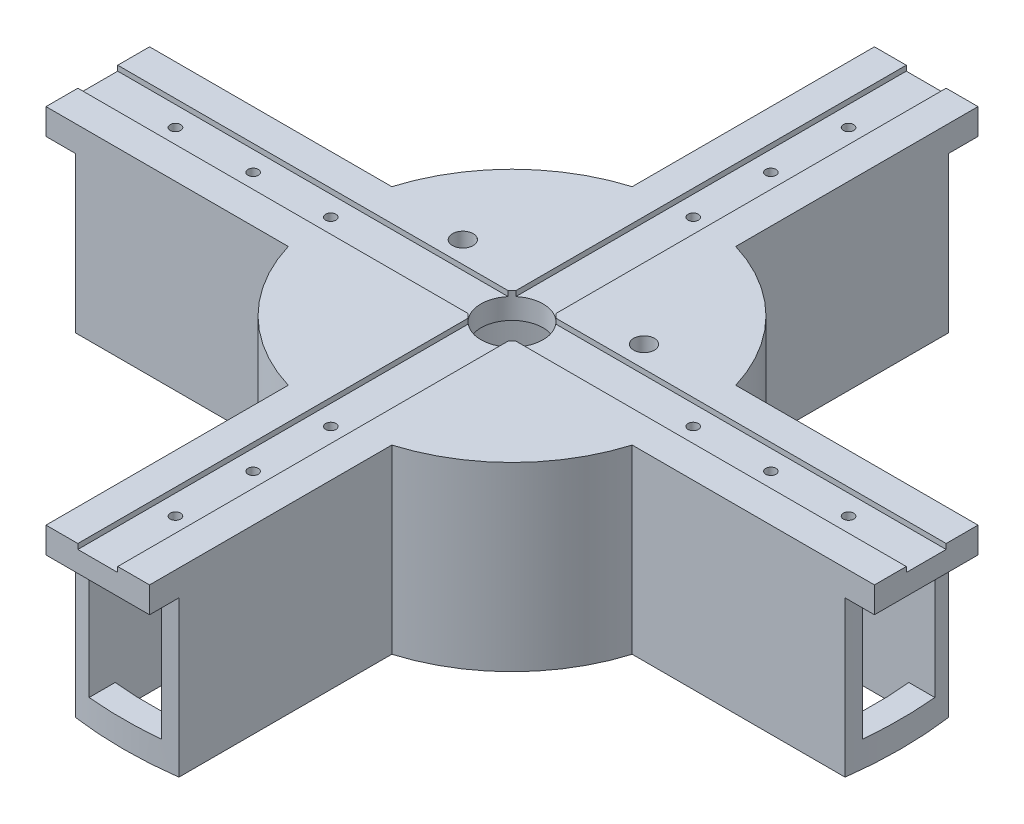
from build123d import *

# Parameters (mm, degrees)
EXTRUDE_1_DEPTH             = 5
EXTRUDE_2_DEPTH             = 25
EXTRUDE_3_DEPTH             = 25
EXTRUDE_4_DEPTH             = 25
EXTRUDE_5_DEPTH             = 25
EXTRUDE_6_DEPTH             = 5
CUT_EXTRUDE_1_DEPTH         = 1
CUT_EXTRUDE_2_DEPTH         = 5
CUT_EXTRUDE_3_DEPTH         = 5
CUT_EXTRUDE_4_DEPTH         = 5
CUT_EXTRUDE_5_DEPTH         = 25
CUT_EXTRUDE_6_DEPTH         = 0.342275074
CUT_EXTRUDE_START           = -5
CUT_EXTRUDE_7_DEPTH         = 5
EXTRUDE_7_DEPTH             = 0.342275074
CUT_EXTRUDE_8_DEPTH         = 25
CUT_EXTRUDE_9_DEPTH         = 0.342275074
CUT_EXTRUDE_10_DEPTH        = 5
EXTRUDE_8_DEPTH             = 0.342275074
EXTRUDE_9_DEPTH             = 5.32738119
EXTRUDE_10_DEPTH            = 5.32738119
EXTRUDE_11_DEPTH            = 5.32738119
CUT_EXTRUDE_11_DEPTH        = 25
EXTRUDE_12_DEPTH            = 5.32738119
HOLE_WIZARD_2_0_2_1_D       = 2
HOLE_WIZARD_2_0_2_1_DEPTH   = 5
HOLE_WIZARD_12_0_12_1_D     = 12
HOLE_WIZARD_12_0_12_1_DEPTH = 5
HOLE_WIZARD_2_0_2_2_D       = 2
HOLE_WIZARD_2_0_2_2_DEPTH   = 34
HOLE_WIZARD_4_0_4_1_D       = 4


with BuildPart() as part:
    # 草图1 → 凸台-拉伸1 (new body)
    with BuildSketch(Plane.XZ.offset(30)):
        with BuildLine():
            Line((-7, 74.67261881), (-10, 74.67261881))
            Line((-10, 74.67261881), (-10, 33.215052396))
            ThreePointArc((-10, 33.215052396), (-24.527940249, 24.527940249), (-33.215052396, 10))
            Line((-33.215052396, 10), (-74.330343737, 10))
            add(Edge.make_bspline(
                [(-74.67261881, 10), (-74.558527119, 10), (-74.444435428, 10), (-74.330343737, 10)],
                knots=[0, 0, 0, 0, 1, 1, 1, 1], degree=3))
            Line((-74.67261881, 10), (-74.67261881, 7))
            ThreePointArc((-74.67261881, 7), (-74.984803207, -1.509731121), (-74.330343737, -10))
            Line((-74.330343737, -10), (-33.215052396, -10))
            ThreePointArc((-33.215052396, -10), (-24.527940249, -24.527940249), (-10, -33.215052396))
            Line((-10, -33.215052396), (-10, -74.330343737))
            ThreePointArc((-10, -74.330343737), (0, -75), (10, -74.330343737))
            Line((10, -74.330343737), (10, -33.215052396))
            ThreePointArc((10, -33.215052396), (24.527940249, -24.527940249), (33.215052396, -10))
            Line((33.215052396, -10), (74.330343737, -10))
            add(Edge.make_bspline(
                [(74.67261881, -10), (74.558527119, -10), (74.444435428, -10), (74.330343737, -10)],
                knots=[0, 0, 0, 0, 1, 1, 1, 1], degree=3))
            Line((74.67261881, -10), (74.67261881, -7))
            ThreePointArc((74.67261881, -7), (74.984803207, 1.509731121), (74.330343737, 10))
            Line((74.330343737, 10), (33.215052396, 10))
            ThreePointArc((33.215052396, 10), (24.527940249, 24.527940249), (10, 33.215052396))
            Line((10, 33.215052396), (10, 74.330343737))
            ThreePointArc((10, 74.330343737), (1.509731121, 74.984803207), (-7, 74.67261881))
        make_face()
        with BuildLine():
            Line((-69.649120597, 7), (-30.904906263, 7))
            ThreePointArc((-30.904906263, 7), (-22.406619905, 22.406619905), (-7, 30.904906263))
            Line((-7, 30.904906263), (-7, 69.649120597))
            ThreePointArc((-7, 69.649120597), (0, 70), (7, 69.649120597))
            Line((7, 69.649120597), (7, 30.904906263))
            ThreePointArc((7, 30.904906263), (22.406619905, 22.406619905), (30.904906263, 7))
            Line((30.904906263, 7), (69.649120597, 7))
            ThreePointArc((69.649120597, 7), (70, 0), (69.649120597, -7))
            Line((69.649120597, -7), (30.904906263, -7))
            ThreePointArc((30.904906263, -7), (22.406619905, -22.406619905), (7, -30.904906263))
            Line((7, -30.904906263), (7, -69.649120597))
            ThreePointArc((7, -69.649120597), (0, -70), (-7, -69.649120597))
            Line((-7, -69.649120597), (-7, -30.904906263))
            ThreePointArc((-7, -30.904906263), (-22.406619905, -22.406619905), (-30.904906263, -7))
            Line((-30.904906263, -7), (-69.649120597, -7))
            ThreePointArc((-69.649120597, -7), (-70, 0), (-69.649120597, 7))
        make_face(mode=Mode.SUBTRACT)
    extrude(amount=-EXTRUDE_1_DEPTH)

    # 草图2 → 凸台-拉伸2 (add)
    with BuildSketch(Plane(origin=(0, -25, 0), x_dir=(-1, 0, 0), z_dir=(0, 1, 0))):
        with BuildLine():
            Line((74.67261881, 7), (30.904906263, 7))
            ThreePointArc((30.904906263, 7), (22.406619905, 22.406619905), (7, 30.904906263))
            Line((7, 30.904906263), (7, 74.67261881))
            Line((7, 74.67261881), (10, 74.67261881))
            Line((10, 74.67261881), (10, 33.215052396))
            ThreePointArc((10, 33.215052396), (24.527940249, 24.527940249), (33.215052396, 10))
            Line((33.215052396, 10), (74.67261881, 10))
            Line((74.67261881, 10), (74.67261881, 7))
        make_face()
    extrude(amount=EXTRUDE_2_DEPTH)

    # 草图3 → 凸台-拉伸3 (add)
    with BuildSketch(Plane(origin=(0, -25, 0), x_dir=(-1, 0, 0), z_dir=(0, 1, 0))):
        with BuildLine():
            Line((-74.67261881, -7), (-30.904906263, -7))
            ThreePointArc((-30.904906263, -7), (-22.406619905, -22.406619905), (-7, -30.904906263))
            Line((-7, -30.904906263), (-7, -74.67261881))
            ThreePointArc((-7, -74.67261881), (-8.501722652, -74.516580114), (-10, -74.330343737))
            Line((-10, -74.330343737), (-10, -33.215052396))
            ThreePointArc((-10, -33.215052396), (-24.527940249, -24.527940249), (-33.215052396, -10))
            Line((-33.215052396, -10), (-74.67261881, -10))
            Line((-74.67261881, -10), (-74.67261881, -7))
        make_face()
    extrude(amount=EXTRUDE_3_DEPTH)

    # 草图4 → 凸台-拉伸4 (add)
    with BuildSketch(Plane(origin=(0, -25, 0), x_dir=(-1, 0, 0), z_dir=(0, 1, 0))):
        with BuildLine():
            Line((-30.904906263, 7), (-74.67261881, 7))
            ThreePointArc((-74.67261881, 7), (-74.516580114, 8.501722652), (-74.330343737, 10))
            Line((-74.330343737, 10), (-33.215052396, 10))
            ThreePointArc((-33.215052396, 10), (-24.527940249, 24.527940249), (-10, 33.215052396))
            Line((-10, 33.215052396), (-10, 74.330343737))
            ThreePointArc((-10, 74.330343737), (-8.501722652, 74.516580114), (-7, 74.67261881))
            Line((-7, 74.67261881), (-7, 30.904906263))
            ThreePointArc((-7, 30.904906263), (-22.406619905, 22.406619905), (-30.904906263, 7))
        make_face()
    extrude(amount=EXTRUDE_4_DEPTH)

    # 草图5 → 凸台-拉伸5 (add)
    with BuildSketch(Plane(origin=(0, -25, 0), x_dir=(-1, 0, 0), z_dir=(0, 1, 0))):
        with BuildLine():
            Line((30.904906263, -7), (74.67261881, -7))
            ThreePointArc((74.67261881, -7), (74.516580114, -8.501722652), (74.330343737, -10))
            Line((74.330343737, -10), (33.215052396, -10))
            ThreePointArc((33.215052396, -10), (24.527940249, -24.527940249), (10, -33.215052396))
            Line((10, -33.215052396), (10, -74.330343737))
            ThreePointArc((10, -74.330343737), (8.501722652, -74.516580114), (7, -74.67261881))
            Line((7, -74.67261881), (7, -30.904906263))
            ThreePointArc((7, -30.904906263), (22.406619905, -22.406619905), (30.904906263, -7))
        make_face()
    extrude(amount=EXTRUDE_5_DEPTH)

    # 草图6 → 凸台-拉伸6 (add)
    with BuildSketch(Plane(origin=(0, 0, 0), x_dir=(-1, 0, 0), z_dir=(0, 1, 0))):
        with BuildLine():
            Line((-74.67261881, -10), (-74.67261881, 7))
            ThreePointArc((-74.67261881, 7), (-74.516580114, 8.501722652), (-74.330343737, 10))
            Line((-74.330343737, 10), (-33.215052396, 10))
            ThreePointArc((-33.215052396, 10), (-24.527940249, 24.527940249), (-10, 33.215052396))
            Line((-10, 33.215052396), (-10, 74.67261881))
            Line((-10, 74.67261881), (10, 74.67261881))
            Line((10, 74.67261881), (10, 33.215052396))
            ThreePointArc((10, 33.215052396), (24.527940249, 24.527940249), (33.215052396, 10))
            Line((33.215052396, 10), (74.330343737, 10))
            add(Edge.make_bspline(
                [(74.67261881, 10), (74.558527119, 10), (74.444435428, 10), (74.330343737, 10)],
                knots=[0, 0, 0, 0, 1, 1, 1, 1], degree=3))
            Line((74.67261881, 10), (74.67261881, -7))
            ThreePointArc((74.67261881, -7), (74.516580114, -8.501722652), (74.330343737, -10))
            Line((74.330343737, -10), (33.215052396, -10))
            ThreePointArc((33.215052396, -10), (24.527940249, -24.527940249), (10, -33.215052396))
            Line((10, -33.215052396), (10, -74.67261881))
            Line((10, -74.67261881), (-10, -74.67261881))
            Line((-10, -74.67261881), (-10, -33.215052396))
            ThreePointArc((-10, -33.215052396), (-24.527940249, -24.527940249), (-33.215052396, -10))
            Line((-33.215052396, -10), (-74.330343737, -10))
            add(Edge.make_bspline(
                [(-74.67261881, -10), (-74.558527119, -10), (-74.444435428, -10), (-74.330343737, -10)],
                knots=[0, 0, 0, 0, 1, 1, 1, 1], degree=3))
        make_face()
    extrude(amount=EXTRUDE_6_DEPTH)

    # 草图7 → 切除-拉伸1 (cut)
    with BuildSketch(Plane(origin=(0, 5, 0), x_dir=(-1, 0, 0), z_dir=(0, 1, 0))):
        with BuildLine():
            Line((3.85, -3.85), (74.330343737, -3.85))
            add(Edge.make_bspline(
                [(74.67261881, -3.85), (74.558527119, -3.85), (74.444435428, -3.85), (74.330343737, -3.85)],
                knots=[0, 0, 0, 0, 1, 1, 1, 1], degree=3))
            Line((74.67261881, -3.85), (74.67261881, 3.85))
            add(Edge.make_bspline(
                [(74.67261881, 3.85), (74.558527119, 3.85), (74.444435428, 3.85), (74.330343737, 3.85)],
                knots=[0, 0, 0, 0, 1, 1, 1, 1], degree=3))
            Line((74.330343737, 3.85), (3.85, 3.85))
            Line((3.85, 3.85), (3.85, 74.67261881))
            Line((3.85, 74.67261881), (-3.85, 74.67261881))
            Line((-3.85, 74.67261881), (-3.85, 3.85))
            Line((-3.85, 3.85), (-74.330343737, 3.85))
            add(Edge.make_bspline(
                [(-74.67261881, 3.85), (-74.558527119, 3.85), (-74.444435428, 3.85), (-74.330343737, 3.85)],
                knots=[0, 0, 0, 0, 1, 1, 1, 1], degree=3))
            Line((-74.67261881, 3.85), (-74.67261881, -3.85))
            add(Edge.make_bspline(
                [(-74.67261881, -3.85), (-74.558527119, -3.85), (-74.444435428, -3.85), (-74.330343737, -3.85)],
                knots=[0, 0, 0, 0, 1, 1, 1, 1], degree=3))
            Line((-74.330343737, -3.85), (-3.85, -3.85))
            Line((-3.85, -3.85), (-3.85, -74.67261881))
            Line((-3.85, -74.67261881), (3.85, -74.67261881))
            Line((3.85, -74.67261881), (3.85, -3.85))
        make_face()
    extrude(amount=-CUT_EXTRUDE_1_DEPTH, mode=Mode.SUBTRACT)

    # 草图8 → 切除-拉伸2 (cut)
    with BuildSketch(Plane.XZ.offset(30)):
        with BuildLine():
            Line((-7, 74.67261881), (-10, 74.67261881))
            Line((-10, 74.67261881), (-10, 74.330343737))
            ThreePointArc((-10, 74.330343737), (-8.501722652, 74.516580114), (-7, 74.67261881))
        make_face()
    extrude(amount=-CUT_EXTRUDE_2_DEPTH, mode=Mode.SUBTRACT)

    # 草图9 → 切除-拉伸3 (cut)
    with BuildSketch(Plane.XZ.offset(30)):
        with BuildLine():
            Line((-74.67261881, 10), (-74.67261881, 7))
            ThreePointArc((-74.67261881, 7), (-74.516580114, 8.501722652), (-74.330343737, 10))
            add(Edge.make_bspline(
                [(-74.67261881, 10), (-74.558527119, 10), (-74.444435428, 10), (-74.330343737, 10)],
                knots=[0, 0, 0, 0, 1, 1, 1, 1], degree=3))
        make_face()
    extrude(amount=-CUT_EXTRUDE_3_DEPTH, mode=Mode.SUBTRACT)

    # 草图10 → 切除-拉伸4 (cut)
    with BuildSketch(Plane.XZ.offset(30)):
        with BuildLine():
            Line((74.67261881, -10), (74.67261881, -7))
            ThreePointArc((74.67261881, -7), (74.516580114, -8.501722652), (74.330343737, -10))
            add(Edge.make_bspline(
                [(74.67261881, -10), (74.558527119, -10), (74.444435428, -10), (74.330343737, -10)],
                knots=[0, 0, 0, 0, 1, 1, 1, 1], degree=3))
        make_face()
    extrude(amount=-CUT_EXTRUDE_4_DEPTH, mode=Mode.SUBTRACT)

    # 草图11 → 切除-拉伸5 (cut)
    with BuildSketch(Plane.XZ.offset(25)):
        with BuildLine():
            Line((-74.67261881, 10), (-74.67261881, 7))
            ThreePointArc((-74.67261881, 7), (-74.516580114, 8.501722652), (-74.330343737, 10))
            add(Edge.make_bspline(
                [(-74.67261881, 10), (-74.558527119, 10), (-74.444435428, 10), (-74.330343737, 10)],
                knots=[0, 0, 0, 0, 1, 1, 1, 1], degree=3))
        make_face()
    extrude(amount=-CUT_EXTRUDE_5_DEPTH, mode=Mode.SUBTRACT)

    # 草图12 → 切除-拉伸6 (cut)
    with BuildSketch(Plane.ZY.offset(74.67261881)):
        Polygon((-3.85, 5), (-7, 5), (-7, 0), (7, 0), (10, 0), (10, 5), (3.85, 5), (3.85, 4), (-3.85, 4), align=None)
    extrude(amount=-CUT_EXTRUDE_6_DEPTH, mode=Mode.SUBTRACT)

    # 草图13 → 切除-拉伸7 (cut)
    with BuildSketch(Plane(origin=(0, 5, 0), x_dir=(-1, 0, 0), z_dir=(0, 1, 0)).offset(CUT_EXTRUDE_START)):
        with BuildLine():
            Line((74.67261881, -7), (74.330343737, -7))
            Line((74.330343737, -7), (74.330343737, -10))
            ThreePointArc((74.330343737, -10), (74.516580114, -8.501722652), (74.67261881, -7))
        make_face()
    extrude(amount=CUT_EXTRUDE_7_DEPTH, mode=Mode.SUBTRACT)

    # 草图14 → 凸台-拉伸7 (add)
    with BuildSketch(Plane.ZY.offset(74.330343737)):
        Polygon((3.85, 4), (3.85, 5), (10, 5), (10, 0), (7, 0), (-7, 0), (-10, 0), (-10, 5), (-3.85, 5), (-3.85, 4), align=None)
    extrude(amount=EXTRUDE_7_DEPTH)

    # 草图15 → 切除-拉伸8 (cut)
    with BuildSketch(Plane.XZ.offset(25)):
        with BuildLine():
            Line((74.67261881, -10), (74.67261881, -7))
            ThreePointArc((74.67261881, -7), (74.516580114, -8.501722652), (74.330343737, -10))
            add(Edge.make_bspline(
                [(74.67261881, -10), (74.558527119, -10), (74.444435428, -10), (74.330343737, -10)],
                knots=[0, 0, 0, 0, 1, 1, 1, 1], degree=3))
        make_face()
    extrude(amount=-CUT_EXTRUDE_8_DEPTH, mode=Mode.SUBTRACT)

    # 草图16 → 切除-拉伸9 (cut)
    with BuildSketch(Plane(origin=(74.67261881, 0, 0), x_dir=(0, 0, -1), z_dir=(1, 0, 0))):
        Polygon((-3.85, 5), (-7, 5), (-7, 0), (7, 0), (10, 0), (10, 5), (3.85, 5), (3.85, 4), (-3.85, 4), align=None)
    extrude(amount=-CUT_EXTRUDE_9_DEPTH, mode=Mode.SUBTRACT)

    # 草图17 → 切除-拉伸10 (cut)
    with BuildSketch(Plane(origin=(0, 5, 0), x_dir=(-1, 0, 0), z_dir=(0, 1, 0)).offset(CUT_EXTRUDE_START)):
        with BuildLine():
            Line((-74.67261881, 7), (-74.330343737, 7))
            Line((-74.330343737, 7), (-74.330343737, 10))
            ThreePointArc((-74.330343737, 10), (-74.516580114, 8.501722652), (-74.67261881, 7))
        make_face()
    extrude(amount=CUT_EXTRUDE_10_DEPTH, mode=Mode.SUBTRACT)

    # 草图18 → 凸台-拉伸8 (add)
    with BuildSketch(Plane(origin=(74.330343737, 0, 0), x_dir=(0, 0, -1), z_dir=(1, 0, 0))):
        Polygon((-3.85, 5), (-3.85, 4), (3.85, 4), (3.85, 5), (10, 5), (10, 0), (7, 0), (-7, 0), (-10, 0), (-10, 5), align=None)
    extrude(amount=EXTRUDE_8_DEPTH)

    # 草图19 → 凸台-拉伸9 (add)
    with BuildSketch(Plane(origin=(0, 0, -74.67261881), x_dir=(-1, 0, 0), z_dir=(0, 0, -1))):
        Polygon((3.85, 4), (3.85, 5), (10, 5), (10, 0), (-10, 0), (-10, 5), (-3.85, 5), (-3.85, 4), align=None)
    extrude(amount=EXTRUDE_9_DEPTH)

    # 草图20 → 凸台-拉伸10 (add)
    with BuildSketch(Plane(origin=(74.67261881, 0, 0), x_dir=(0, 0, -1), z_dir=(1, 0, 0))):
        Polygon((-3.85, 5), (-3.85, 4), (3.85, 4), (3.85, 5), (10, 5), (10, 0), (-10, 0), (-10, 5), align=None)
    extrude(amount=EXTRUDE_10_DEPTH)

    # 草图21 → 凸台-拉伸11 (add)
    with BuildSketch(Plane.ZY.offset(74.67261881)):
        Polygon((3.85, 4), (3.85, 5), (10, 5), (10, 0), (-10, 0), (-10, 5), (-3.85, 5), (-3.85, 4), align=None)
    extrude(amount=EXTRUDE_11_DEPTH)

    # 草图22 → 切除-拉伸11 (cut)
    with BuildSketch(Plane.XZ.offset(25)):
        with BuildLine():
            Line((-7, 74.67261881), (-10, 74.67261881))
            Line((-10, 74.67261881), (-10, 74.330343737))
            ThreePointArc((-10, 74.330343737), (-8.501722652, 74.516580114), (-7, 74.67261881))
        make_face()
    extrude(amount=-CUT_EXTRUDE_11_DEPTH, mode=Mode.SUBTRACT)

    # 草图23 → 凸台-拉伸12 (add)
    with BuildSketch(Plane.XY.offset(74.67261881)):
        Polygon((3.85, 4), (3.85, 5), (10, 5), (10, 0), (-10, 0), (-10, 5), (-3.85, 5), (-3.85, 4), align=None)
    extrude(amount=EXTRUDE_12_DEPTH)

    # Ø2.0 (2) 直径孔1
    with Locations(Plane(origin=(0, 0, 0), x_dir=(-1, 0, 0), z_dir=(0, -1, 0))):
        with Locations((-50, 0), (-35, 0), (-65, 0), (50, 0), (35, 0), (65, 0)):
            Hole(HOLE_WIZARD_2_0_2_1_D / 2, depth=HOLE_WIZARD_2_0_2_1_DEPTH)

    # Ø12.0 (12) 直径孔1
    with Locations(Plane(origin=(0, 0, 0), x_dir=(-1, 0, 0), z_dir=(0, -1, 0))):
        with Locations((0, 0)):
            Hole(HOLE_WIZARD_12_0_12_1_D / 2, depth=HOLE_WIZARD_12_0_12_1_DEPTH)

    # Ø2.0 (2) 直径孔2
    with Locations(Plane(origin=(0, 4, 0), x_dir=(1, 0, 0), z_dir=(0, 1, 0))):
        with Locations((0, -65), (0, 65), (0, 35), (0, 50), (0, -50), (0, -35)):
            Hole(HOLE_WIZARD_2_0_2_2_D / 2, depth=HOLE_WIZARD_2_0_2_2_DEPTH)

    # Ø4.0 (4) 直径孔1 (through all)
    with Locations(Plane(origin=(0, 0, 0), x_dir=(-1, 0, 0), z_dir=(0, -1, 0))):
        with Locations((-17.5, 8), (17.5, 8)):
            Hole(HOLE_WIZARD_4_0_4_1_D / 2)


solid = part.part
